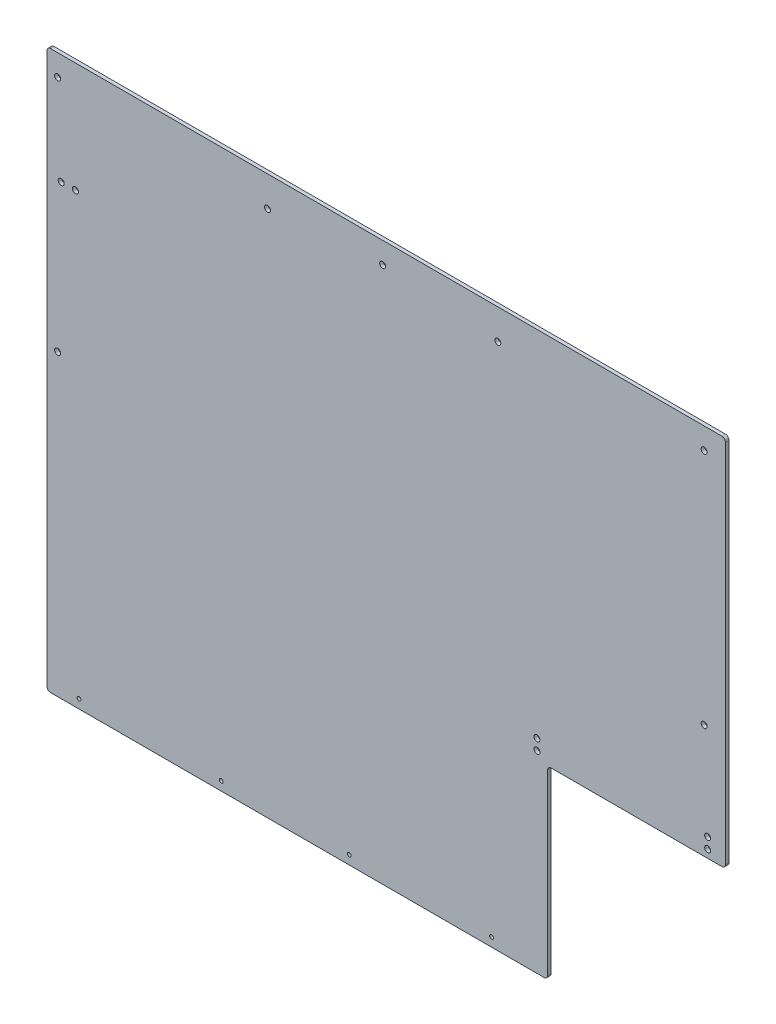
from build123d import *

# Parameters (mm, degrees)
SKETCH1_W                        = 1223.9625
SKETCH1_H                        = 1976.755
BOSS_EXTRUDE1_DEPTH              = 3.175
CUT_EXTRUDE1_DEPTH               = 1163.519443002
F_1_4_CLEARANCE_HOLE1_D          = 6.7564
F_27_64_0_42188_DIAMETER_HOLE1_D = 10.715752
F_27_64_0_42188_DIAMETER_HOLE3_D = 10.715752
F_27_64_0_42188_DIAMETER_HOLE2_D = 10.715752
SKETCH9_W                        = 1223.9625
SKETCH9_H                        = 9.525
CUT_EXTRUDE2_DEPTH               = 1163.519443002
FILLET1_R                        = 6.35
FILLET2_R                        = 6.35
F_27_64_0_42188_DIAMETER_HOLE4_D = 10.715752
CUT_EXTRUDE3_DEPTH               = 1155.432150283


with BuildPart() as part:
    # Sketch1 → Boss-Extrude1 (new, symmetric)
    with BuildSketch(Plane.XY):
        Rectangle(SKETCH1_W, SKETCH1_H)
    extrude(amount=BOSS_EXTRUDE1_DEPTH, both=True)

    # Sketch2 → Cut-Extrude1 (cut, through all)
    with BuildSketch(Plane.XY.offset(3.175)):
        Polygon((294.48125, 313.3725), (611.98125, 313.3725), (611.98125, -23.1775), (611.98125, -988.3775), (-611.98125, -988.3775), (-611.98125, -23.1775), (294.48125, -23.1775), align=None)
    extrude(amount=-CUT_EXTRUDE1_DEPTH, mode=Mode.SUBTRACT)

    # 1/4 Clearance Hole1 (through all)
    with Locations(Plane.XY.offset(3.175)):
        with Locations((-542.13125, -0.9525), (-288.13125, -0.9525), (-59.53125, -0.9525), (194.46875, -0.9525)):
            Hole(F_1_4_CLEARANCE_HOLE1_D / 2)

    # 27/64 (0.42188) Diameter Hole1 (through all)
    with Locations(Plane(origin=(573.88125, 516.5725, 3.175), x_dir=(1, 0, 0), z_dir=(0, 0, 1))):
        with Locations((0, 0), (-1154.1125, 0)):
            Hole(F_27_64_0_42188_DIAMETER_HOLE1_D / 2)

    # 27/64 (0.42188) Diameter Hole3 (through all)
    with Locations(Plane(origin=(275.43125, 327.66, 3.175), x_dir=(1, 0, 0), z_dir=(0, 0, 1))):
        with Locations((0, 0), (304.8, 0), (304.8, 19.05), (0, 19.05)):
            Hole(F_27_64_0_42188_DIAMETER_HOLE3_D / 2)

    # 27/64 (0.42188) Diameter Hole2 (through all)
    with Locations(Plane.XY.offset(3.175)):
        with Locations((205.58125, 924.8775), (573.88125, 940.7525), (0, 940.7525), (-580.23125, 940.7525), (-205.58125, 924.8775)):
            Hole(F_27_64_0_42188_DIAMETER_HOLE2_D / 2)

    # Sketch9 → Cut-Extrude2 (cut, through all)
    with BuildSketch(Plane.XY.offset(3.175)):
        with Locations((0, 983.615)):
            Rectangle(SKETCH9_W, SKETCH9_H)
    extrude(amount=-CUT_EXTRUDE2_DEPTH, mode=Mode.SUBTRACT)

    # Fillet1
    fillet1_edges = [part.edges().sort_by_distance(p)[0] for p in [
        (294.48125, 313.3725, 0),
    ]]
    fillet(fillet1_edges, radius=FILLET1_R)

    # Fillet2
    fillet2_edges = [part.edges().sort_by_distance(p)[0] for p in [
        (611.98125, 978.8525, 0),
        (-611.98125, 978.8525, 0),
        (294.48125, -23.1775, 0),
        (611.98125, 313.3725, 0),
        (-611.98125, -23.1775, 0),
    ]]
    fillet(fillet2_edges, radius=FILLET2_R)

    # 27/64 (0.42188) Diameter Hole4 (through all)
    with Locations(Plane.XY.offset(3.175)):
        with Locations((-573.88125, 782.0025), (-548.48125, 782.0025)):
            Hole(F_27_64_0_42188_DIAMETER_HOLE4_D / 2)

    # Sketch12 → Cut-Extrude3 (cut, through all)
    with BuildSketch(Plane.XY.offset(3.175)):
        with BuildLine():
            Line((288.13125, -16.8275), (-592.93125, -16.8275))
            ThreePointArc((-592.93125, -16.8275), (-597.421378061, -14.967628061), (-599.28125, -10.4775))
            Line((-599.28125, -10.4775), (-599.28125, 972.5025))
            ThreePointArc((-599.28125, 972.5025), (-597.421378061, 976.992628061), (-592.93125, 978.8525))
            Line((-592.93125, 978.8525), (-605.63125, 978.8525))
            ThreePointArc((-605.63125, 978.8525), (-610.121378061, 976.992628061), (-611.98125, 972.5025))
            Line((-611.98125, 972.5025), (-611.98125, -16.8275))
            ThreePointArc((-611.98125, -16.8275), (-610.121378061, -21.317628061), (-605.63125, -23.1775))
            Line((-605.63125, -23.1775), (288.13125, -23.1775))
            ThreePointArc((288.13125, -23.1775), (292.621378061, -21.317628061), (294.48125, -16.8275))
            Line((294.48125, -16.8275), (294.48125, -10.4775))
            ThreePointArc((294.48125, -10.4775), (292.621378061, -14.967628061), (288.13125, -16.8275))
        make_face()
    extrude(amount=-CUT_EXTRUDE3_DEPTH, mode=Mode.SUBTRACT)


solid = part.part
